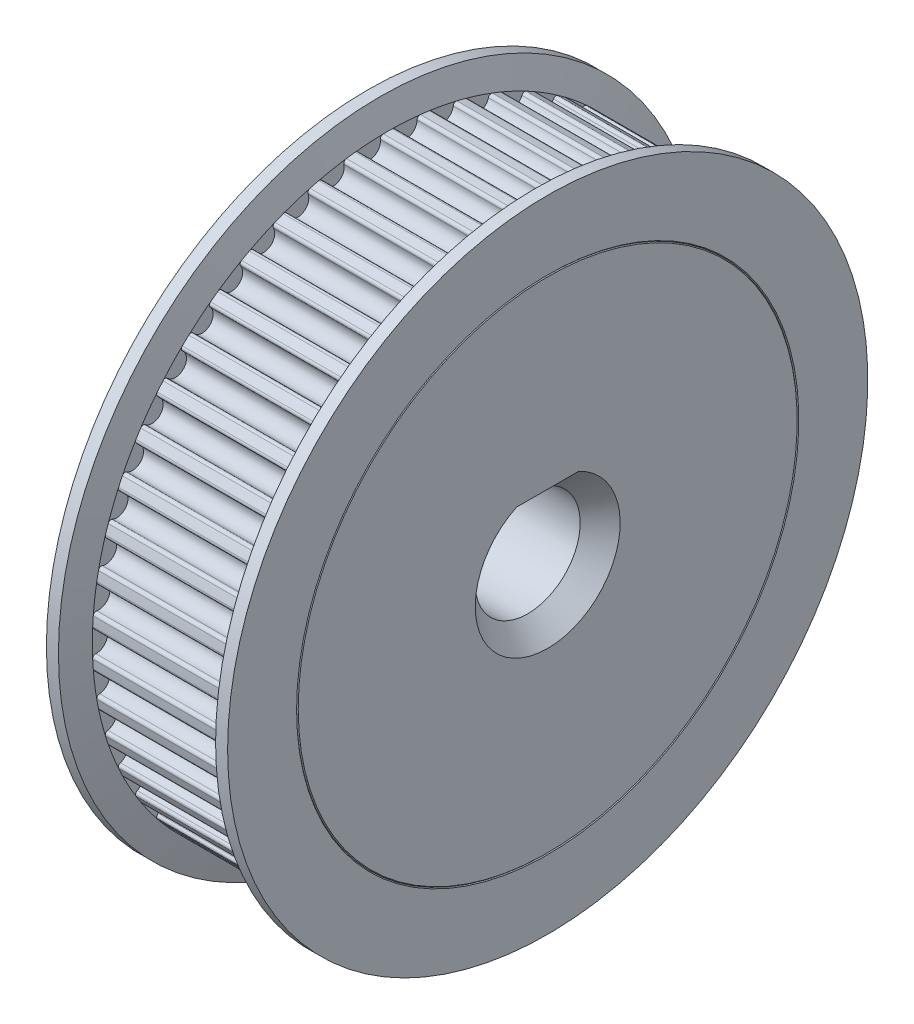
from build123d import *

# Parameters (mm, degrees)
BORE_DEPTH      = 28.241599687
F_20TOOTH_START = -1
SKETCH_3_R      = 0.55
F_20TOOTH_DEPTH = 7
FILLET_1_R      = 0.15
CHAMFER4_SIZE   = 1
CHAMFER5_SIZE   = 1


with BuildPart() as part:
    # Эскиз1 → Body (revolve)
    with BuildSketch(Plane.XY, mode=Mode.PRIVATE) as body_sk:
        Polygon((0, 0), (0, 7.282429663), (0.2, 7.5), (6, 7.5), (6, 12.480518109), (6.041209047, 12.521727156), (6, 12.562936203), (6, 16.079563948), (6.601820111, 16.079563948), (7, 14.78), (14, 14.78), (14.398179889, 16.014212221), (15, 16.014212221), (15, 12.562936203), (14.958790953, 12.521727156), (15, 12.480518109), (15, 0), align=None)
    revolve(body_sk.sketch.rotate(Axis((0, 0, 0), (1, 0, 0)), 90), axis=Axis((0, 0, 0), (1, 0, 0)))

    # Эскиз2 → Bore (cut, through all)
    with BuildSketch(Plane(origin=(15, 0, 0), x_dir=(0, 0, -1), z_dir=(1, 0, 0))):
        with BuildLine():
            Line((-1.309580085, 2.275), (1.309580085, 2.275))
            ThreePointArc((1.309580085, 2.275), (0, -2.625), (-1.309580085, 2.275))
        make_face()
    extrude(amount=-BORE_DEPTH, mode=Mode.SUBTRACT)

    # Эскиз3 → 20tooth (cut)
    with BuildSketch(Plane.ZY.offset(-6).offset(F_20TOOTH_START)):
        with Locations((14.457356915, -1.826388913)):
            Circle(SKETCH_3_R)
        with Locations((-11.789208871, -8.565361616)):
            Circle(SKETCH_3_R)
        with Locations((14.114449109, -3.623974582)):
            Circle(SKETCH_3_R)
        with Locations((13.548948009, -5.364408007)):
            Circle(SKETCH_3_R)
        with Locations((12.769771906, -7.020241513)):
            Circle(SKETCH_3_R)
        with Locations((11.789208871, -8.565361616)):
            Circle(SKETCH_3_R)
        with Locations((14.572263566, 0)):
            Circle(SKETCH_3_R)
        with Locations((10.62272297, -9.975400851)):
            Circle(SKETCH_3_R)
        with Locations((9.288710382, -11.228122054)):
            Circle(SKETCH_3_R)
        with Locations((7.808209282, -12.303769066)):
            Circle(SKETCH_3_R)
        with Locations((6.204568057, -13.18537829)):
            Circle(SKETCH_3_R)
        with Locations((4.503077088, -13.859046221)):
            Circle(SKETCH_3_R)
        with Locations((2.730569903, -14.314148715)):
            Circle(SKETCH_3_R)
        with Locations((0.915, -14.543508532)):
            Circle(SKETCH_3_R)
        with Locations((-0.915, -14.543508532)):
            Circle(SKETCH_3_R)
        with Locations((-12.769771906, -7.020241513)):
            Circle(SKETCH_3_R)
        with Locations((-13.548948009, -5.364408007)):
            Circle(SKETCH_3_R)
        with Locations((-2.730569903, -14.314148715)):
            Circle(SKETCH_3_R)
        with Locations((-4.503077088, -13.859046221)):
            Circle(SKETCH_3_R)
        with Locations((-6.204568057, -13.18537829)):
            Circle(SKETCH_3_R)
        with Locations((-7.808209282, -12.303769066)):
            Circle(SKETCH_3_R)
        with Locations((-9.288710382, -11.228122054)):
            Circle(SKETCH_3_R)
        with Locations((-10.62272297, -9.975400851)):
            Circle(SKETCH_3_R)
        with Locations((-14.114449109, -3.623974582)):
            Circle(SKETCH_3_R)
        with Locations((-14.457356915, -1.826388913)):
            Circle(SKETCH_3_R)
        with Locations((-14.572263566, 0)):
            Circle(SKETCH_3_R)
        with Locations((-14.457356915, 1.826388913)):
            Circle(SKETCH_3_R)
        with Locations((-14.114449109, 3.623974582)):
            Circle(SKETCH_3_R)
        with Locations((-13.548948009, 5.364408007)):
            Circle(SKETCH_3_R)
        with Locations((-12.769771906, 7.020241513)):
            Circle(SKETCH_3_R)
        with Locations((-11.789208871, 8.565361616)):
            Circle(SKETCH_3_R)
        with Locations((-10.62272297, 9.975400851)):
            Circle(SKETCH_3_R)
        with Locations((-9.288710382, 11.228122054)):
            Circle(SKETCH_3_R)
        with Locations((-7.808209282, 12.303769066)):
            Circle(SKETCH_3_R)
        with Locations((-6.204568057, 13.18537829)):
            Circle(SKETCH_3_R)
        with Locations((-4.503077088, 13.859046221)):
            Circle(SKETCH_3_R)
        with Locations((-2.730569903, 14.314148715)):
            Circle(SKETCH_3_R)
        with Locations((-0.915, 14.543508532)):
            Circle(SKETCH_3_R)
        with Locations((0.915, 14.543508532)):
            Circle(SKETCH_3_R)
        with Locations((2.730569903, 14.314148715)):
            Circle(SKETCH_3_R)
        with Locations((4.503077088, 13.859046221)):
            Circle(SKETCH_3_R)
        with Locations((6.204568057, 13.18537829)):
            Circle(SKETCH_3_R)
        with Locations((7.808209282, 12.303769066)):
            Circle(SKETCH_3_R)
        with Locations((9.288710382, 11.228122054)):
            Circle(SKETCH_3_R)
        with Locations((10.62272297, 9.975400851)):
            Circle(SKETCH_3_R)
        with Locations((11.789208871, 8.565361616)):
            Circle(SKETCH_3_R)
        with Locations((12.769771906, 7.020241513)):
            Circle(SKETCH_3_R)
        with Locations((13.548948009, 5.364408007)):
            Circle(SKETCH_3_R)
        with Locations((14.114449109, 3.623974582)):
            Circle(SKETCH_3_R)
        with Locations((14.457356915, 1.826388913)):
            Circle(SKETCH_3_R)
    extrude(amount=-F_20TOOTH_DEPTH, mode=Mode.SUBTRACT)

    # Скругление1
    fillet_1_edges = [part.edges().sort_by_distance(p)[0] for p in [
        (10.5, -11.054458416, 9.810573334),
        (10.5, -11.708200058, 9.020335437),
        (10.5, -12.196881588, 8.347723014),
        (10.5, -12.746425212, 7.481780826),
        (10.5, -13.146952652, 6.753224116),
        (10.5, -13.583631625, 5.825234061),
        (10.5, -13.889688419, 5.052222839),
        (10.5, -14.206616054, 4.076819876),
        (10.5, -14.413375503, 3.27154499),
        (10.5, -14.605553661, 2.264111805),
        (10.5, -14.709755044, 1.439272923),
        (10.5, -14.774152961, 0.415697339),
        (10.5, -14.774152961, -0.415697339),
        (10.5, -14.709755044, -1.439272923),
        (10.5, -14.605553661, -2.264111805),
        (10.5, -14.413375503, -3.27154499),
        (10.5, -14.206616054, -4.076819876),
        (10.5, -13.889688419, -5.052222839),
        (10.5, -13.583631625, -5.825234061),
        (10.5, -13.146952652, -6.753224116),
        (10.5, -12.746425212, -7.481780826),
        (10.5, -12.196881588, -8.347723014),
        (10.5, -11.708200058, -9.020335437),
        (10.5, -11.054458416, -9.810573334),
        (10.5, -10.485329595, -10.416633971),
        (10.5, -9.73769983, -11.118705051),
        (10.5, -9.097099221, -11.648655964),
        (10.5, -8.267371902, -12.251488148),
        (10.5, -7.565402158, -12.696971694),
        (10.5, -6.666662579, -13.191057958),
        (10.5, -5.914394183, -13.545048595),
        (10.5, -4.960816006, -13.922596904),
        (10.5, -4.170112679, -14.179511989),
        (10.5, -3.1767344, -14.43456818),
        (10.5, -2.360066008, -14.590356008),
        (10.5, -1.342553795, -14.718897693),
        (10.5, -0.512799685, -14.771101397),
        (10.5, 0.512799685, -14.771101397),
        (10.5, 1.342553795, -14.718897693),
        (10.5, 2.360066008, -14.590356008),
        (10.5, 3.1767344, -14.43456818),
        (10.5, 4.170112679, -14.179511989),
        (10.5, 4.960816006, -13.922596904),
        (10.5, 5.914394183, -13.545048595),
        (10.5, 6.666662579, -13.191057958),
        (10.5, 7.565402158, -12.696971694),
        (10.5, 8.267371902, -12.251488148),
        (10.5, 9.097099221, -11.648655964),
        (10.5, 9.73769983, -11.118705051),
        (10.5, 10.485329595, -10.416633971),
        (10.5, 11.054458416, -9.810573334),
        (10.5, 11.708200058, -9.020335437),
        (10.5, 12.196881588, -8.347723014),
        (10.5, 12.746425212, -7.481780826),
        (10.5, 13.146952652, -6.753224116),
        (10.5, 13.583631625, -5.825234061),
        (10.5, 13.889688419, -5.052222839),
        (10.5, 14.206616054, -4.076819876),
        (10.5, 14.413375503, -3.27154499),
        (10.5, 14.605553661, -2.264111805),
        (10.5, 14.709755044, -1.439272923),
        (10.5, 14.774152961, -0.415697339),
        (10.5, 14.774152961, 0.415697339),
        (10.5, 14.709755044, 1.439272923),
        (10.5, 14.605553661, 2.264111805),
        (10.5, 14.413375503, 3.27154499),
        (10.5, 14.206616054, 4.076819876),
        (10.5, 13.889688419, 5.052222839),
        (10.5, 13.583631625, 5.825234061),
        (10.5, 13.146952652, 6.753224116),
        (10.5, 12.746425212, 7.481780826),
        (10.5, 12.196881588, 8.347723014),
        (10.5, 11.708200058, 9.020335437),
        (10.5, 11.054458416, 9.810573334),
        (10.5, 10.485329595, 10.416633971),
        (10.5, 9.73769983, 11.118705051),
        (10.5, 9.097099221, 11.648655964),
        (10.5, 8.267371902, 12.251488148),
        (10.5, 7.565402158, 12.696971694),
        (10.5, 6.666662579, 13.191057958),
        (10.5, 5.914394183, 13.545048595),
        (10.5, 4.960816006, 13.922596904),
        (10.5, 4.170112679, 14.179511989),
        (10.5, 3.1767344, 14.43456818),
        (10.5, 2.360066008, 14.590356008),
        (10.5, 1.342553795, 14.718897693),
        (10.5, -1.342553795, 14.718897693),
        (10.5, -2.360066008, 14.590356008),
        (10.5, -3.1767344, 14.43456818),
        (10.5, -4.170112679, 14.179511989),
        (10.5, -4.960816006, 13.922596904),
        (10.5, -5.914394183, 13.545048595),
        (10.5, -6.666662579, 13.191057958),
        (10.5, -7.565402158, 12.696971694),
        (10.5, -8.267371902, 12.251488148),
        (10.5, -9.097099221, 11.648655964),
        (10.5, 0.512799685, 14.771101397),
        (10.5, -0.512799685, 14.771101397),
        (10.5, -9.73769983, 11.118705051),
        (10.5, -10.485329595, 10.416633971),
    ]]
    fillet(fillet_1_edges, radius=FILLET_1_R)

    # Chamfer4
    chamfer4_edges = [part.edges().sort_by_distance(p)[0] for p in [
        (0, -2.625, 0),
        (0, 2.275, 0),
    ]]
    chamfer(chamfer4_edges, length=CHAMFER4_SIZE)

    # Chamfer5
    chamfer5_edges = [part.edges().sort_by_distance(p)[0] for p in [
        (15, -2.625, 0),
        (15, 2.275, 0),
    ]]
    chamfer(chamfer5_edges, length=CHAMFER5_SIZE)


solid = part.part
